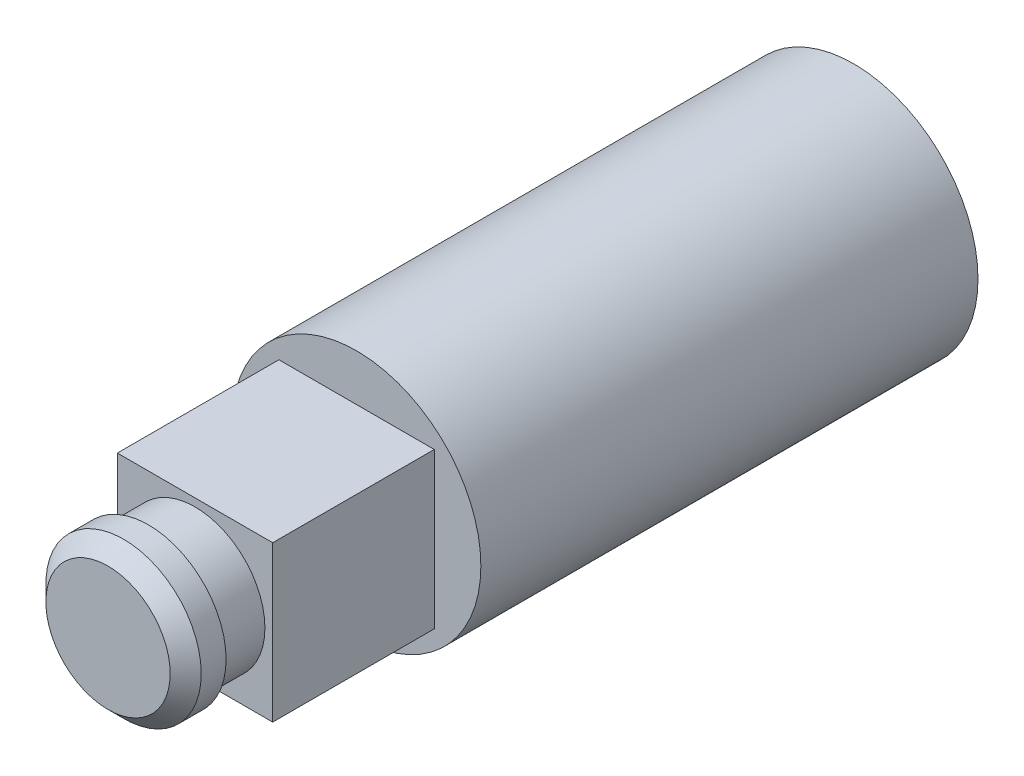
from build123d import *

# Parameters (mm, degrees)
SKETCH_1_R          = 4
EXTRUDE_1_DEPTH     = 8
SKETCH_2_W          = 5
SKETCH_2_H          = 5
EXTRUDE_2_DEPTH     = 5.2
SKETCH_3_R          = 2.5
EXTRUDE_3_DEPTH     = 2.8
SKETCH_4_OUTSIDE_W  = 15.306
SKETCH_4_OUTSIDE_H  = 15.306
SKETCH_4_OUTSIDE_R  = 2.25
CUT_EXTRUDE_1_DEPTH = 1.5
CHAMFER_1_SIZE      = 0.5


with BuildPart() as part:
    # 草图1 → 凸台-拉伸1 (new, symmetric)
    with BuildSketch(Plane.XY):
        Circle(SKETCH_1_R)
    extrude(amount=EXTRUDE_1_DEPTH, both=True)

    # 草图2 → 凸台-拉伸2 (add)
    with BuildSketch(Plane.XY.offset(8)):
        Rectangle(SKETCH_2_W, SKETCH_2_H)
    extrude(amount=EXTRUDE_2_DEPTH)

    # 草图3 → 凸台-拉伸3 (add)
    with BuildSketch(Plane.XY.offset(13.2)):
        Circle(SKETCH_3_R)
    extrude(amount=EXTRUDE_3_DEPTH)

    # 草图4 outside → 切除-拉伸1 (cut)
    with BuildSketch(Plane.XY.offset(13.2)):
        Rectangle(SKETCH_4_OUTSIDE_W, SKETCH_4_OUTSIDE_H)
        Circle(SKETCH_4_OUTSIDE_R, mode=Mode.SUBTRACT)
    extrude(amount=CUT_EXTRUDE_1_DEPTH, mode=Mode.SUBTRACT)

    # 倒角1
    chamfer_1_edges = [part.edges().sort_by_distance(p)[0] for p in [
        (-2.5, 0, 16),
    ]]
    chamfer(chamfer_1_edges, length=CHAMFER_1_SIZE)


solid = part.part
